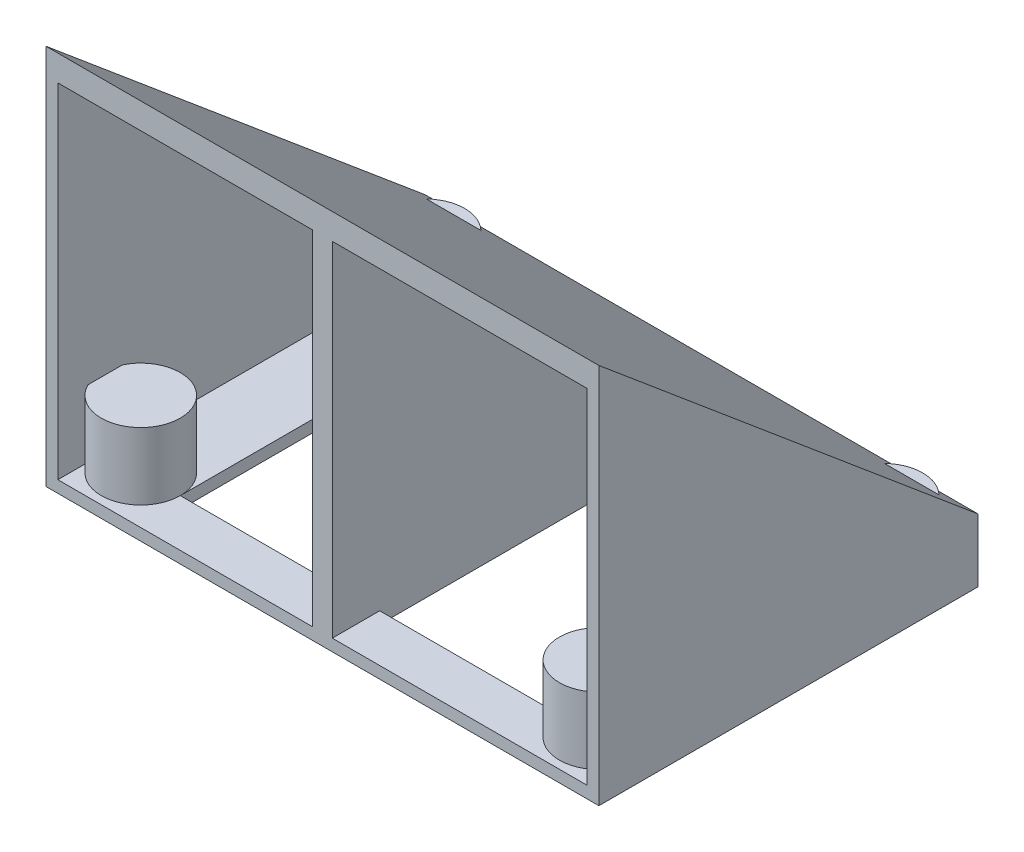
from build123d import *

# Parameters (mm, degrees)
SKETCH1_W            = 70
SKETCH1_H            = 48
BOSS_EXTRUDE1_DEPTH  = 1.5
BOSS_EXTRUDE6_DEPTH  = 70
BOSS_EXTRUDE7_DEPTH  = 1.5
BOSS_EXTRUDE8_DEPTH  = 1.5
SKETCH9_R            = 5
BOSS_EXTRUDE9_DEPTH  = 10
SKETCH10_R           = 2.8
CUT_EXTRUDE1_DEPTH   = 8
SKETCH11_W           = 48
SKETCH11_H           = 36
CUT_EXTRUDE2_DEPTH   = 1.6
BOSS_EXTRUDE10_REACH = 74.403
SKETCH12_W           = 2.5
SKETCH12_H           = 48


with BuildPart() as part:
    # Sketch1 → Boss-Extrude1 (new body)
    with BuildSketch(Plane(origin=(0, 0, 0), x_dir=(1, 0, 0), z_dir=(0, 1, 0))):
        with Locations((-11.991596639, -2.521008403)):
            Rectangle(SKETCH1_W, SKETCH1_H)
    extrude(amount=BOSS_EXTRUDE1_DEPTH)

    # Sketch6 → Boss-Extrude6 (add)
    with BuildSketch(Plane(origin=(23.008403361, 0, 0), x_dir=(0, 0, -1), z_dir=(1, 0, 0))):
        Polygon((18.978991597, 1.5), (21.478991597, 1.5), (21.478991597, 8), (-26.521008403, 48.276782297), (-26.521008403, 45.013264073), (-24.021008403, 42.915514995), (18.978991597, 6.834230855), align=None)
    extrude(amount=-BOSS_EXTRUDE6_DEPTH)

    # Sketch7 → Boss-Extrude7 (add)
    with BuildSketch(Plane(origin=(23.008403361, 0, 0), x_dir=(0, 0, -1), z_dir=(1, 0, 0))):
        Polygon((-26.521008403, 1.5), (18.978991597, 1.5), (18.978991597, 6.834230855), (-26.521008403, 45.013264073), align=None)
    extrude(amount=-BOSS_EXTRUDE7_DEPTH)

    # Sketch8 → Boss-Extrude8 (add)
    with BuildSketch(Plane.ZY.offset(46.991596639)):
        Polygon((-18.978991597, 6.834230855), (26.521008403, 45.013264073), (26.521008403, 1.5), (-18.978991597, 1.5), align=None)
    extrude(amount=-BOSS_EXTRUDE8_DEPTH)

    # Sketch9 → Boss-Extrude9 (add)
    with BuildSketch(Plane.XZ):
        with Locations((17.008403361, -15.478991597)):
            Circle(SKETCH9_R)
        with Locations((-40.991596639, -15.478991597)):
            Circle(SKETCH9_R)
        with Locations((-40.991596639, 20.521008403)):
            Circle(SKETCH9_R)
        with Locations((17.008403361, 20.521008403)):
            Circle(SKETCH9_R)
    extrude(amount=-BOSS_EXTRUDE9_DEPTH)

    # Sketch10 → Cut-Extrude1 (cut)
    with BuildSketch(Plane.XZ):
        with Locations(Location((17.008403361, -15.478991597, 0), (0, 0, 270))):
            Circle(SKETCH10_R)
        with Locations(Location((-40.991596639, -15.478991597, 0), (0, 0, 270))):
            Circle(SKETCH10_R)
        with Locations(Location((-40.991596639, 20.521008403, 0), (0, 0, 270))):
            Circle(SKETCH10_R)
        with Locations(Location((17.008403361, 20.521008403, 0), (0, 0, 270))):
            Circle(SKETCH10_R)
    extrude(amount=-CUT_EXTRUDE1_DEPTH, mode=Mode.SUBTRACT)

    # Sketch11 → Cut-Extrude2 (cut)
    with BuildSketch(Plane.XZ):
        with Locations((-11.991596639, 2.521008403)):
            Rectangle(SKETCH11_W, SKETCH11_H)
    extrude(amount=-CUT_EXTRUDE2_DEPTH, mode=Mode.SUBTRACT)

    # Boss-Extrude10: up to this plane
    boss_extrude10_end = Plane(origin=(-46.991596639, 13.355820328, -11.206863912), z_dir=(0, 0.7660444431189827, -0.6427876096865339))
    # Sketch12 → Boss-Extrude10 (add, up to the surface)
    with BuildSketch(Plane.XZ, mode=Mode.PRIVATE) as boss_extrude10_sk1:
        with Locations((-11.991596639, 2.521008403)):
            Rectangle(SKETCH12_W, SKETCH12_H)
    boss_extrude10_tool1 = split(extrude(boss_extrude10_sk1.sketch, amount=-BOSS_EXTRUDE10_REACH, mode=Mode.PRIVATE), bisect_by=boss_extrude10_end, keep=Keep.BOTH, mode=Mode.PRIVATE)
    add(boss_extrude10_tool1.solids().sort_by_distance((-11.991597, 0, 2.521008))[0])


solid = part.part
